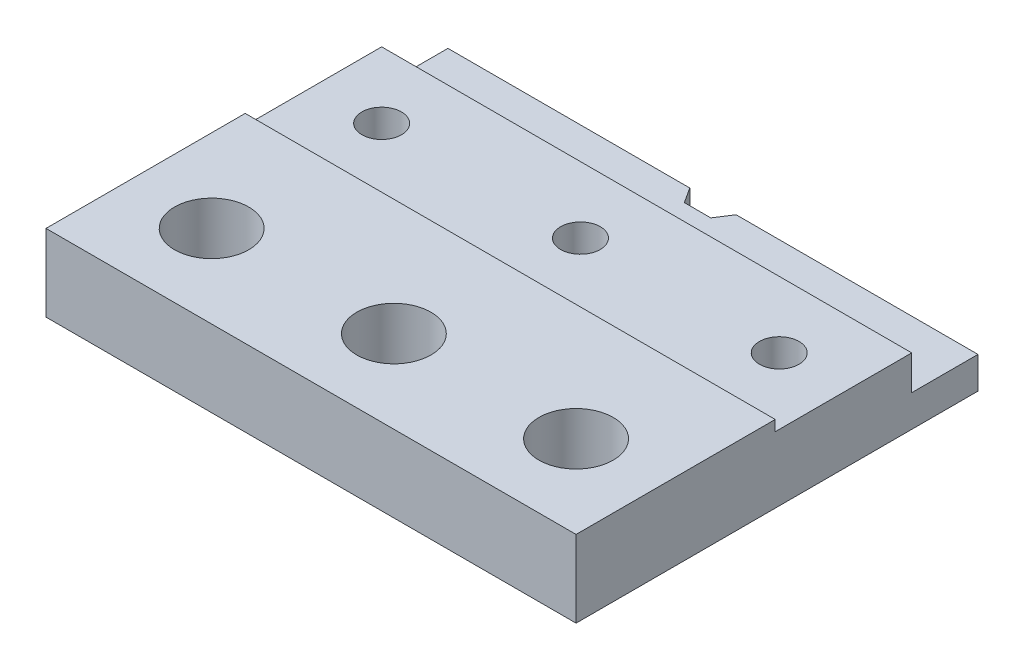
from build123d import *

# Parameters (mm, degrees)
CROQUIS1_W                          = 50.8
CROQUIS1_H                          = 38.5191
SALIENTE_EXTRUIR1_DEPTH             = 7.366
CORTAR_EXTRUIR1_DEPTH               = 55.825434081
TALADROS_DE_ESPIGA_DE_5_16_0_28_1_D = 7.112
CORTAR_EXTRUIR2_DEPTH               = 33.167303123
TALADRO_ROSCADO_10_241_D            = 3.7973


with BuildPart() as part:
    # Croquis1 → Saliente-Extruir1 (new body)
    with BuildSketch(Plane(origin=(0, 0, 0), x_dir=(1, 0, 0), z_dir=(0, 1, 0))):
        Rectangle(CROQUIS1_W, CROQUIS1_H)
    extrude(amount=SALIENTE_EXTRUIR1_DEPTH)

    # Croquis2 → Cortar-Extruir1 (cut, through all)
    with BuildSketch(Plane(origin=(25.4, 0, 0), x_dir=(0, 0, -1), z_dir=(1, 0, 0))):
        Polygon((19.25955, 3.048), (12.90955, 3.048), (12.90955, 6.35), (-0.17145, 6.35), (-0.17145, 7.366), (19.25955, 7.366), align=None)
    extrude(amount=-CORTAR_EXTRUIR1_DEPTH, mode=Mode.SUBTRACT)

    # Taladros de espiga de 5/16 (0.28)1 (through all)
    with Locations(Plane(origin=(0, 7.366, 0), x_dir=(1, 0, 0), z_dir=(0, 1, 0))):
        with Locations((17.4625, -11.32205), (0, -11.32205), (-17.4625, -11.32205)):
            Hole(TALADROS_DE_ESPIGA_DE_5_16_0_28_1_D / 2)

    # Croquis5 → Cortar-Extruir2 (cut, through all)
    with BuildSketch(Plane(origin=(0, 3.048, 0), x_dir=(1, 0, 0), z_dir=(0, 1, 0))):
        Polygon((-2.2225, 19.25955), (-1.27, 17.78635), (1.27, 17.78635), (2.2225, 19.25955), align=None)
    extrude(amount=-CORTAR_EXTRUIR2_DEPTH, mode=Mode.SUBTRACT)

    # Taladro roscado #10-241 (through all)
    with Locations(Plane(origin=(0, 6.35, 0), x_dir=(1, 0, 0), z_dir=(0, 1, 0))):
        with Locations((19.05, 6.55955), (0, 6.55955), (-19.05, 6.55955)):
            Hole(TALADRO_ROSCADO_10_241_D / 2)


solid = part.part
